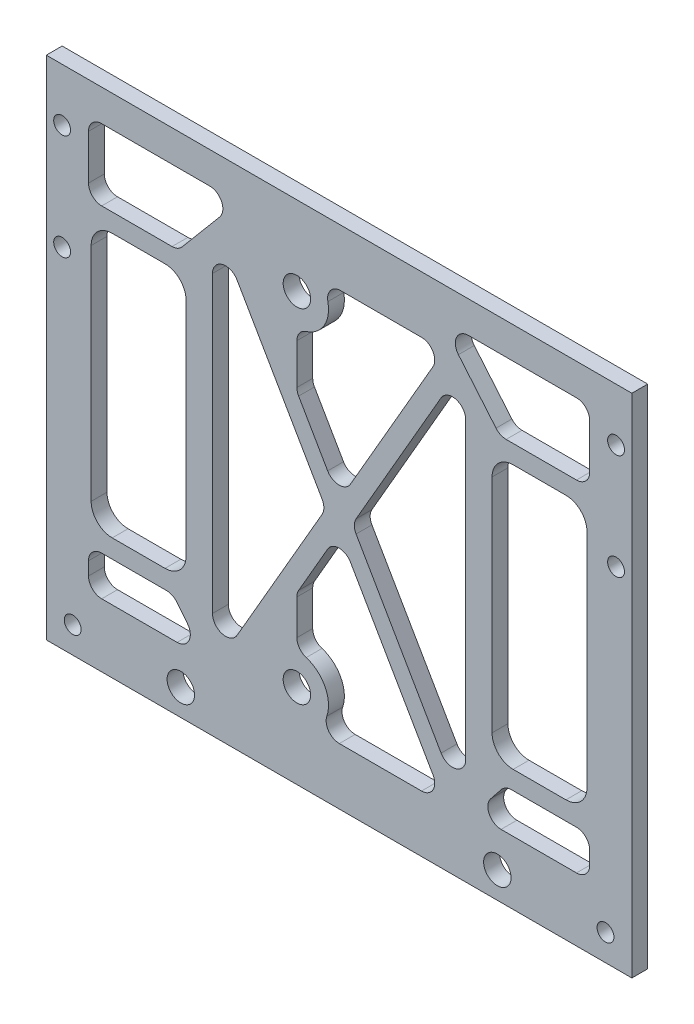
from build123d import *

# Parameters (mm, degrees)
SKETCH_1_W           = 111
SKETCH_1_H           = 96
EXTRUDE_1_DEPTH      = 3
SKETCH_2_R           = 1.6
CUT_EXTRUDE_1_DEPTH  = 74.438749989
SKETCH_3_R           = 2.6
CUT_EXTRUDE_2_DEPTH  = 74.438749989
SKETCH_4_R           = 1.6
CUT_EXTRUDE_3_DEPTH  = 74.438749989
SKETCH_8_R           = 2.6
CUT_EXTRUDE_10_DEPTH = 74.438749989
SKETCH_5_W           = 18
SKETCH_5_H           = 50
CUT_EXTRUDE_4_DEPTH  = 74.438749989
FILLET_1_R           = 4
CUT_EXTRUDE_8_DEPTH  = 74.438749989
FILLET_2_R           = 2.5
CUT_EXTRUDE_9_DEPTH  = 74.438749989
FILLET_3_R           = 2.5


with BuildPart() as part:
    # 草图1 → 凸台-拉伸1 (new body)
    with BuildSketch(Plane.XY):
        Rectangle(SKETCH_1_W, SKETCH_1_H)
    extrude(amount=EXTRUDE_1_DEPTH)

    # 草图2 → 切除-拉伸1 (cut, through all)
    with BuildSketch(Plane.XY.offset(3)):
        with Locations((-50.5, -43)):
            Circle(SKETCH_2_R)
        with Locations((50.5, -43)):
            Circle(SKETCH_2_R)
    extrude(amount=-CUT_EXTRUDE_1_DEPTH, mode=Mode.SUBTRACT)

    # 草图3 → 切除-拉伸2 (cut, through all)
    with BuildSketch(Plane.XY.offset(3)):
        with Locations((-30, -43)):
            Circle(SKETCH_3_R)
        with Locations(Location((30, -43, 0), (0, 0, 180))):
            Circle(SKETCH_3_R)
    extrude(amount=-CUT_EXTRUDE_2_DEPTH, mode=Mode.SUBTRACT)

    # 草图4 → 切除-拉伸3 (cut, through all)
    with BuildSketch(Plane.XY.offset(3)):
        with Locations((-52.5, 18)):
            Circle(SKETCH_4_R)
        with Locations((-52.5, 38)):
            Circle(SKETCH_4_R)
        with Locations(Location((52.5, 38, 0), (0, 0, 180))):
            Circle(SKETCH_4_R)
        with Locations(Location((52.5, 18, 0), (0, 0, 180))):
            Circle(SKETCH_4_R)
    extrude(amount=-CUT_EXTRUDE_3_DEPTH, mode=Mode.SUBTRACT)

    # 草图8 → 切除-拉伸10 (cut, through all)
    with BuildSketch(Plane.XY.offset(3)):
        with Locations((-8, -32)):
            Circle(SKETCH_8_R)
        with Locations((-8, 33)):
            Circle(SKETCH_8_R)
    extrude(amount=-CUT_EXTRUDE_10_DEPTH, mode=Mode.SUBTRACT)

    # 草图5 → 切除-拉伸4 (cut, through all)
    with BuildSketch(Plane.XY.offset(3)):
        with Locations((-38, 0)):
            Rectangle(SKETCH_5_W, SKETCH_5_H)
        with Locations((38, 0)):
            Rectangle(SKETCH_5_W, SKETCH_5_H)
    extrude(amount=-CUT_EXTRUDE_4_DEPTH, mode=Mode.SUBTRACT)

    # 圆角1
    fillet_1_edges = [part.edges().sort_by_distance(p)[0] for p in [
        (-47, 25, 1.5),
        (-29, 25, 1.5),
        (-29, -25, 1.5),
        (-47, -25, 1.5),
        (47, -25, 1.5),
        (29, -25, 1.5),
        (29, 25, 1.5),
        (47, 25, 1.5),
    ]]
    fillet(fillet_1_edges, radius=FILLET_1_R)

    # 草图6 → 切除-拉伸8 (cut, through all)
    with BuildSketch(Plane.XY.offset(3)):
        with BuildLine():
            ThreePointArc((-3.753813954, 37.239092363), (-2.457683058, 30.70158252), (-8, 27))
            Line((-8, 27), (-8, 16.526279442))
            Line((-8, 16.526279442), (0, 2.669872981))
            Line((0, 2.669872981), (19.958548116, 37.239092363))
            Line((19.958548116, 37.239092363), (-3.753813954, 37.239092363))
        make_face()
        with BuildLine():
            Line((-8, -16.526279442), (-8, -26))
            ThreePointArc((-8, -26), (-2.193342004, -30.489131736), (-5.075634904, -37.239092363))
            Line((-5.075634904, -37.239092363), (19.958548116, -37.239092363))
            Line((19.958548116, -37.239092363), (0, -2.669872981))
            Line((0, -2.669872981), (-8, -16.526279442))
        make_face()
        Polygon((-2.5, 0), (-24, 37.239092363), (-24, -37.239092363), align=None)
        Polygon((24, -37.239092363), (24, 37.239092363), (2.5, 0), align=None)
    extrude(amount=-CUT_EXTRUDE_8_DEPTH, mode=Mode.SUBTRACT)

    # 圆角2
    fillet_2_edges = [part.edges().sort_by_distance(p)[0] for p in [
        (24, -37.239092363, 1.5),
        (2.5, 0, 1.5),
        (24, 37.239092363, 1.5),
        (-8, 27, 1.5),
        (-3.753813954, 37.239092363, 1.5),
        (19.958548116, 37.239092363, 1.5),
        (0, 2.669872981, 1.5),
        (-8, 16.526279442, 1.5),
        (-5.075634904, -37.239092363, 1.5),
        (-8, -26, 1.5),
        (-8, -16.526279442, 1.5),
        (0, -2.669872981, 1.5),
        (19.958548116, -37.239092363, 1.5),
        (-24, -37.239092363, 1.5),
        (-24, 37.239092363, 1.5),
        (-2.5, 0, 1.5),
    ]]
    fillet(fillet_2_edges, radius=FILLET_2_R)

    # 草图7 → 切除-拉伸9 (cut, through all)
    with BuildSketch(Plane.XY.offset(3)):
        Polygon((-19.172154979, 42), (-47.5, 42), (-47.5, 38), (-47.5, 28.5), (-30.5, 28.5), align=None)
        Polygon((-47.5, -36), (-47.5, -28.5), (-31.5, -28.5), (-25.5, -36), align=None)
        Polygon((25.5, -36), (47.5, -36), (47.5, -28.5), (31.5, -28.5), align=None)
        Polygon((47.5, 42), (47.5, 38), (47.5, 28.5), (30.5, 28.5), (19.172154979, 42), align=None)
    extrude(amount=-CUT_EXTRUDE_9_DEPTH, mode=Mode.SUBTRACT)

    # 圆角3
    fillet_3_edges = [part.edges().sort_by_distance(p)[0] for p in [
        (47.5, 42, 1.5),
        (47.5, 28.5, 1.5),
        (30.5, 28.5, 1.5),
        (19.172154979, 42, 1.5),
        (47.5, -36, 1.5),
        (25.5, -36, 1.5),
        (31.5, -28.5, 1.5),
        (47.5, -28.5, 1.5),
        (-47.5, -36, 1.5),
        (-47.5, -28.5, 1.5),
        (-31.5, -28.5, 1.5),
        (-25.5, -36, 1.5),
        (-47.5, 42, 1.5),
        (-19.172154979, 42, 1.5),
        (-30.5, 28.5, 1.5),
        (-47.5, 28.5, 1.5),
    ]]
    fillet(fillet_3_edges, radius=FILLET_3_R)


solid = part.part
